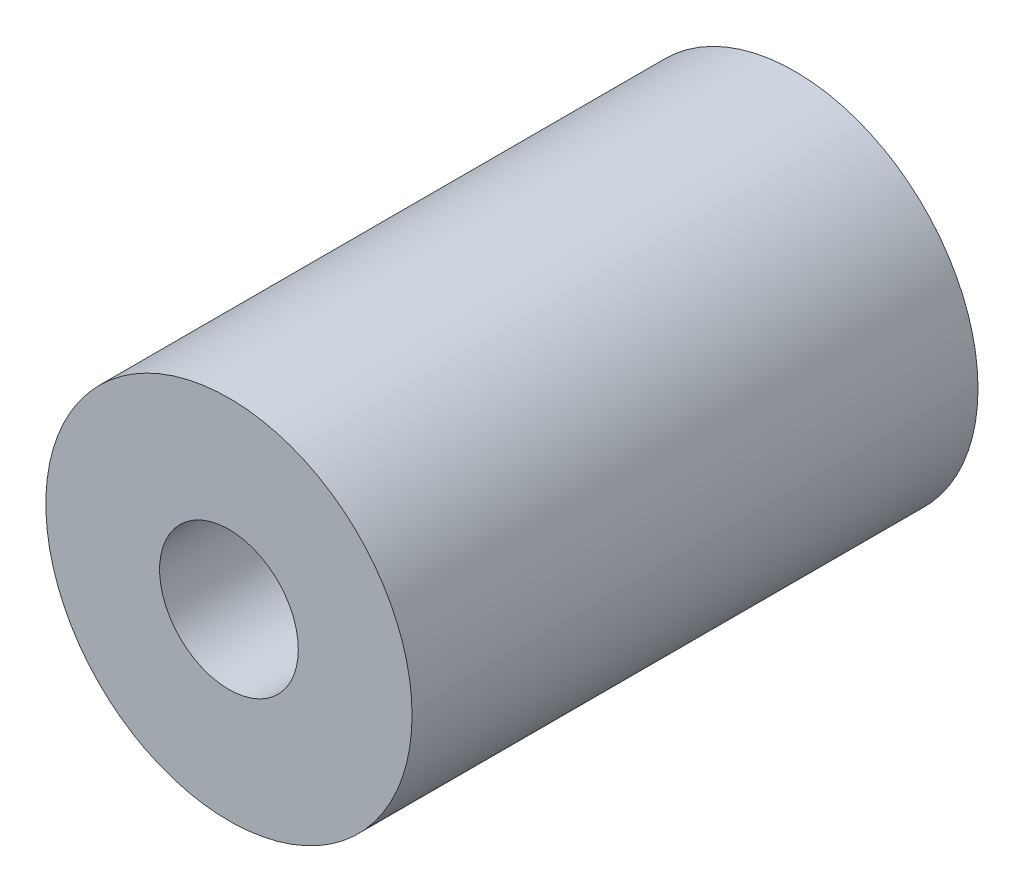
from build123d import *

# Parameters (mm, degrees)
SKETCH1_R           = 33
SKETCH1_R_2         = 12.5
BOSS_EXTRUDE1_DEPTH = 102


with BuildPart() as part:
    # Sketch1 → Boss-Extrude1 (new body)
    with BuildSketch(Plane.XY):
        Circle(SKETCH1_R)
        Circle(SKETCH1_R_2, mode=Mode.SUBTRACT)
    extrude(amount=BOSS_EXTRUDE1_DEPTH)


solid = part.part
